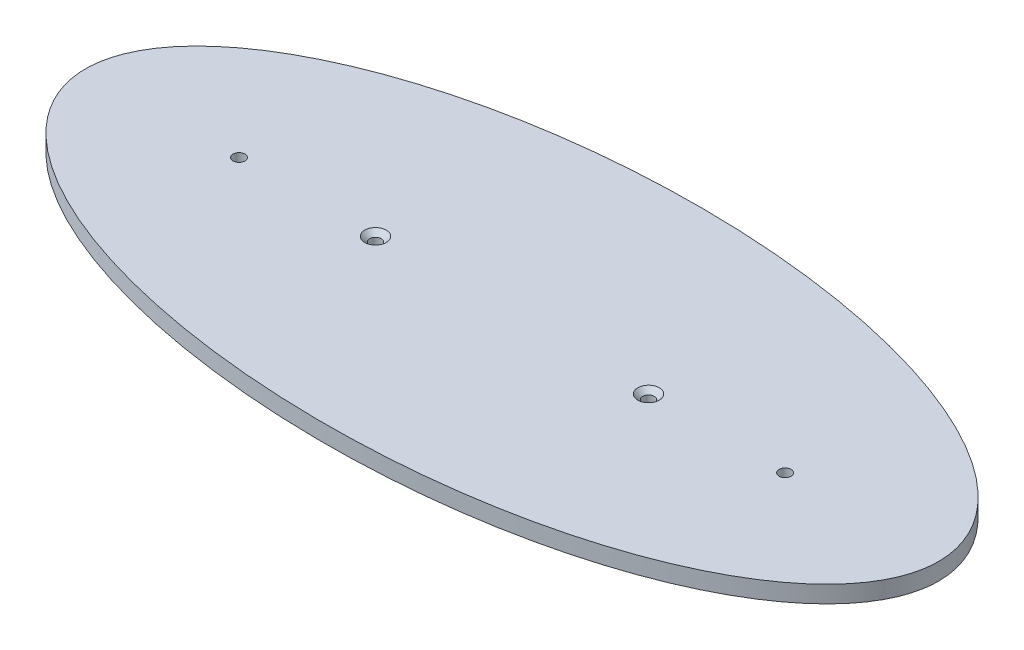
from build123d import *

# Parameters (mm, degrees)
SKETCH_1_RX                  = 125
SKETCH_1_RY                  = 55
EXTRUDE_1_DEPTH              = 5
HOLE_WIZARD_M3_1_D           = 3.4
HOLE_WIZARD_M3_1_CSINK_D     = 6.3
HOLE_WIZARD_M3_1_CSINK_ANGLE = 90
SKETCH_8_R                   = 1.75
CUT_EXTRUDE_1_DEPTH          = 137.656503687


with BuildPart() as part:
    # ｽｹｯﾁ1 → ﾎﾞｽ - 押し出し1 (new body)
    with BuildSketch(Plane(origin=(0, 0, 0), x_dir=(1, 0, 0), z_dir=(0, 1, 0))):
        with Locations((0, 0)):
            Ellipse(SKETCH_1_RX, SKETCH_1_RY)
    extrude(amount=EXTRUDE_1_DEPTH)

    # M3 丸皿小ねじ用皿穴1 (through all)
    with Locations(Plane(origin=(0, 5, 0), x_dir=(-1, 0, 0), z_dir=(0, 1, 0))):
        with Locations((40, 0), (-40, 0)):
            CounterSinkHole(HOLE_WIZARD_M3_1_D / 2, HOLE_WIZARD_M3_1_CSINK_D / 2, counter_sink_angle=HOLE_WIZARD_M3_1_CSINK_ANGLE)

    # ｽｹｯﾁ8 → ｶｯﾄ - 押し出し1 (cut, through all)
    with BuildSketch(Plane(origin=(0, 5, 0), x_dir=(1, 0, 0), z_dir=(0, 1, 0))):
        with Locations(Location((-80, 0, 0), (0, 0, 270))):
            Circle(SKETCH_8_R)
        with Locations(Location((80, 0, 0), (0, 0, 270))):
            Circle(SKETCH_8_R)
    extrude(amount=-CUT_EXTRUDE_1_DEPTH, mode=Mode.SUBTRACT)


solid = part.part
